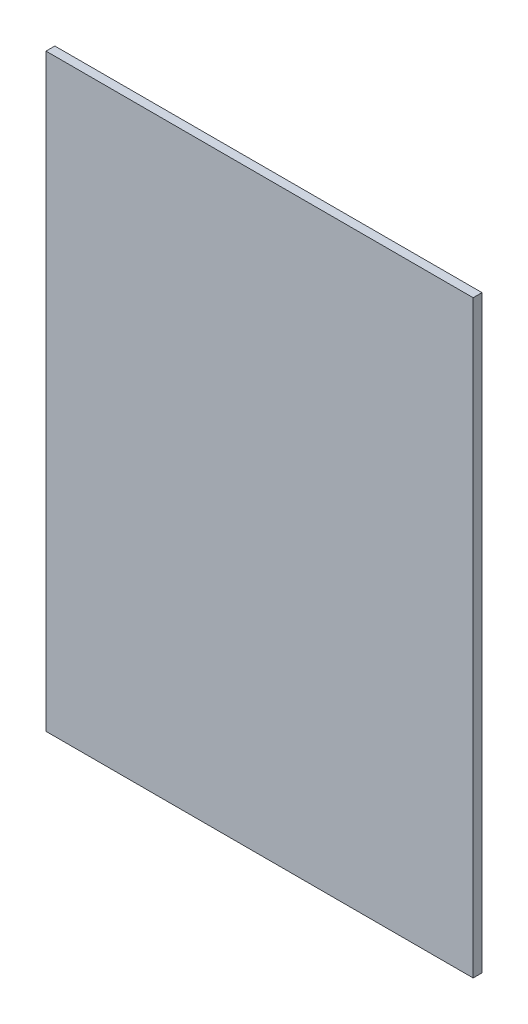
from build123d import *

# Parameters (mm, degrees)
ESBO_O1_W                = 145
ESBO_O1_H                = 200
RESSALTO_EXTRUS_O1_DEPTH = 3


with BuildPart() as part:
    # Esboço1 → Ressalto-extrusão1 (new body)
    with BuildSketch(Plane.XY):
        Rectangle(ESBO_O1_W, ESBO_O1_H)
    extrude(amount=RESSALTO_EXTRUS_O1_DEPTH)


solid = part.part
